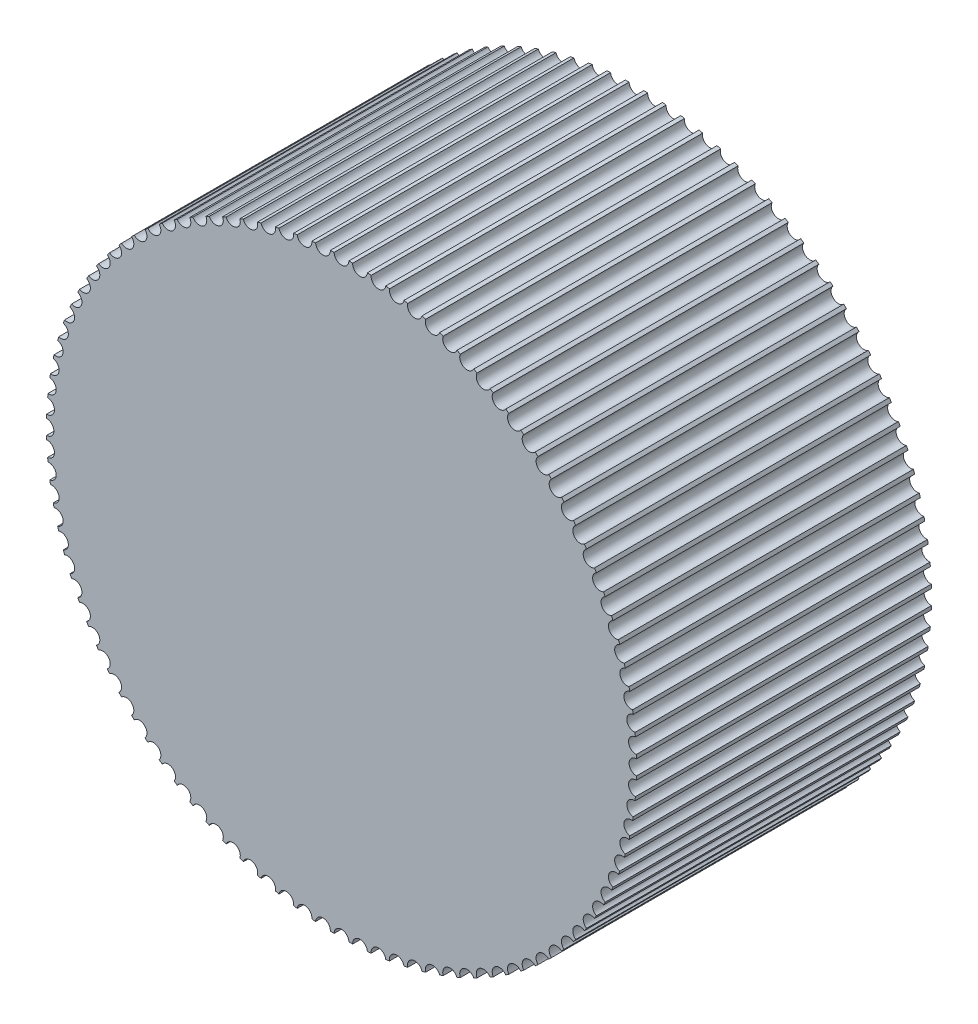
from build123d import *

# Parameters (mm, degrees)
SKETCH1_R           = 2
BOSS_EXTRUDE1_DEPTH = 2
SKETCH2_R           = 0.05
CUT_EXTRUDE4_DEPTH  = 3


with BuildPart() as part:
    # Sketch1 → Boss-Extrude1 (new body)
    with BuildSketch(Plane.XY):
        Circle(SKETCH1_R)
    extrude(amount=BOSS_EXTRUDE1_DEPTH)

    # Sketch2 → Cut-Extrude4 (cut)
    with BuildSketch(Plane.XY.offset(2)):
        with Locations((0, 2)):
            Circle(SKETCH2_R)
        with Locations((0.125581039, 1.996053457)):
            Circle(SKETCH2_R)
        with Locations((0.250666467, 1.984229403)):
            Circle(SKETCH2_R)
        with Locations((0.374762629, 1.964574501)):
            Circle(SKETCH2_R)
        with Locations((0.497379774, 1.937166322)):
            Circle(SKETCH2_R)
        with Locations((0.618033989, 1.902113033)):
            Circle(SKETCH2_R)
        with Locations((0.736249105, 1.859552972)):
            Circle(SKETCH2_R)
        with Locations((0.851558583, 1.809654105)):
            Circle(SKETCH2_R)
        with Locations((0.963507348, 1.75261336)):
            Circle(SKETCH2_R)
        with Locations((1.07165359, 1.688655851)):
            Circle(SKETCH2_R)
        with Locations((1.175570505, 1.618033989)):
            Circle(SKETCH2_R)
        with Locations((1.274847979, 1.541026486)):
            Circle(SKETCH2_R)
        with Locations((1.369094212, 1.457937255)):
            Circle(SKETCH2_R)
        with Locations((1.457937255, 1.369094212)):
            Circle(SKETCH2_R)
        with Locations((1.541026486, 1.274847979)):
            Circle(SKETCH2_R)
        with Locations((1.618033989, 1.175570505)):
            Circle(SKETCH2_R)
        with Locations((1.688655851, 1.07165359)):
            Circle(SKETCH2_R)
        with Locations((1.75261336, 0.963507348)):
            Circle(SKETCH2_R)
        with Locations((1.809654105, 0.851558583)):
            Circle(SKETCH2_R)
        with Locations((1.859552972, 0.736249105)):
            Circle(SKETCH2_R)
        with Locations((1.902113033, 0.618033989)):
            Circle(SKETCH2_R)
        with Locations((1.937166322, 0.497379774)):
            Circle(SKETCH2_R)
        with Locations((1.964574501, 0.374762629)):
            Circle(SKETCH2_R)
        with Locations((1.984229403, 0.250666467)):
            Circle(SKETCH2_R)
        with Locations((1.996053457, 0.125581039)):
            Circle(SKETCH2_R)
        with Locations((2, 0)):
            Circle(SKETCH2_R)
        with Locations((1.996053457, -0.125581039)):
            Circle(SKETCH2_R)
        with Locations((1.984229403, -0.250666467)):
            Circle(SKETCH2_R)
        with Locations((1.964574501, -0.374762629)):
            Circle(SKETCH2_R)
        with Locations((1.937166322, -0.497379774)):
            Circle(SKETCH2_R)
        with Locations((1.902113033, -0.618033989)):
            Circle(SKETCH2_R)
        with Locations((1.859552972, -0.736249105)):
            Circle(SKETCH2_R)
        with Locations((1.809654105, -0.851558583)):
            Circle(SKETCH2_R)
        with Locations((1.75261336, -0.963507348)):
            Circle(SKETCH2_R)
        with Locations((1.688655851, -1.07165359)):
            Circle(SKETCH2_R)
        with Locations((1.618033989, -1.175570505)):
            Circle(SKETCH2_R)
        with Locations((1.541026486, -1.274847979)):
            Circle(SKETCH2_R)
        with Locations((1.457937255, -1.369094212)):
            Circle(SKETCH2_R)
        with Locations((1.369094212, -1.457937255)):
            Circle(SKETCH2_R)
        with Locations((1.274847979, -1.541026486)):
            Circle(SKETCH2_R)
        with Locations((1.175570505, -1.618033989)):
            Circle(SKETCH2_R)
        with Locations((1.07165359, -1.688655851)):
            Circle(SKETCH2_R)
        with Locations((0.963507348, -1.75261336)):
            Circle(SKETCH2_R)
        with Locations((0.851558583, -1.809654105)):
            Circle(SKETCH2_R)
        with Locations((0.736249105, -1.859552972)):
            Circle(SKETCH2_R)
        with Locations((0.618033989, -1.902113033)):
            Circle(SKETCH2_R)
        with Locations((0.497379774, -1.937166322)):
            Circle(SKETCH2_R)
        with Locations((0.374762629, -1.964574501)):
            Circle(SKETCH2_R)
        with Locations((0.250666467, -1.984229403)):
            Circle(SKETCH2_R)
        with Locations((0.125581039, -1.996053457)):
            Circle(SKETCH2_R)
        with Locations((0, -2)):
            Circle(SKETCH2_R)
        with Locations((-0.125581039, -1.996053457)):
            Circle(SKETCH2_R)
        with Locations((-0.250666467, -1.984229403)):
            Circle(SKETCH2_R)
        with Locations((-0.374762629, -1.964574501)):
            Circle(SKETCH2_R)
        with Locations((-0.497379774, -1.937166322)):
            Circle(SKETCH2_R)
        with Locations((-0.618033989, -1.902113033)):
            Circle(SKETCH2_R)
        with Locations((-0.736249105, -1.859552972)):
            Circle(SKETCH2_R)
        with Locations((-0.851558583, -1.809654105)):
            Circle(SKETCH2_R)
        with Locations((-0.963507348, -1.75261336)):
            Circle(SKETCH2_R)
        with Locations((-1.07165359, -1.688655851)):
            Circle(SKETCH2_R)
        with Locations((-1.175570505, -1.618033989)):
            Circle(SKETCH2_R)
        with Locations((-1.274847979, -1.541026486)):
            Circle(SKETCH2_R)
        with Locations((-1.369094212, -1.457937255)):
            Circle(SKETCH2_R)
        with Locations((-1.457937255, -1.369094212)):
            Circle(SKETCH2_R)
        with Locations((-1.541026486, -1.274847979)):
            Circle(SKETCH2_R)
        with Locations((-1.618033989, -1.175570505)):
            Circle(SKETCH2_R)
        with Locations((-1.688655851, -1.07165359)):
            Circle(SKETCH2_R)
        with Locations((-1.75261336, -0.963507348)):
            Circle(SKETCH2_R)
        with Locations((-1.809654105, -0.851558583)):
            Circle(SKETCH2_R)
        with Locations((-1.859552972, -0.736249105)):
            Circle(SKETCH2_R)
        with Locations((-1.902113033, -0.618033989)):
            Circle(SKETCH2_R)
        with Locations((-1.937166322, -0.497379774)):
            Circle(SKETCH2_R)
        with Locations((-1.964574501, -0.374762629)):
            Circle(SKETCH2_R)
        with Locations((-1.984229403, -0.250666467)):
            Circle(SKETCH2_R)
        with Locations((-1.996053457, -0.125581039)):
            Circle(SKETCH2_R)
        with Locations((-2, 0)):
            Circle(SKETCH2_R)
        with Locations((-1.996053457, 0.125581039)):
            Circle(SKETCH2_R)
        with Locations((-1.984229403, 0.250666467)):
            Circle(SKETCH2_R)
        with Locations((-1.964574501, 0.374762629)):
            Circle(SKETCH2_R)
        with Locations((-1.937166322, 0.497379774)):
            Circle(SKETCH2_R)
        with Locations((-1.902113033, 0.618033989)):
            Circle(SKETCH2_R)
        with Locations((-1.859552972, 0.736249105)):
            Circle(SKETCH2_R)
        with Locations((-1.809654105, 0.851558583)):
            Circle(SKETCH2_R)
        with Locations((-1.75261336, 0.963507348)):
            Circle(SKETCH2_R)
        with Locations((-1.688655851, 1.07165359)):
            Circle(SKETCH2_R)
        with Locations((-1.618033989, 1.175570505)):
            Circle(SKETCH2_R)
        with Locations((-1.541026486, 1.274847979)):
            Circle(SKETCH2_R)
        with Locations((-1.457937255, 1.369094212)):
            Circle(SKETCH2_R)
        with Locations((-1.369094212, 1.457937255)):
            Circle(SKETCH2_R)
        with Locations((-1.274847979, 1.541026486)):
            Circle(SKETCH2_R)
        with Locations((-1.175570505, 1.618033989)):
            Circle(SKETCH2_R)
        with Locations((-1.07165359, 1.688655851)):
            Circle(SKETCH2_R)
        with Locations((-0.963507348, 1.75261336)):
            Circle(SKETCH2_R)
        with Locations((-0.851558583, 1.809654105)):
            Circle(SKETCH2_R)
        with Locations((-0.736249105, 1.859552972)):
            Circle(SKETCH2_R)
        with Locations((-0.618033989, 1.902113033)):
            Circle(SKETCH2_R)
        with Locations((-0.497379774, 1.937166322)):
            Circle(SKETCH2_R)
        with Locations((-0.374762629, 1.964574501)):
            Circle(SKETCH2_R)
        with Locations((-0.250666467, 1.984229403)):
            Circle(SKETCH2_R)
        with Locations((-0.125581039, 1.996053457)):
            Circle(SKETCH2_R)
    extrude(amount=-CUT_EXTRUDE4_DEPTH, mode=Mode.SUBTRACT)


solid = part.part
